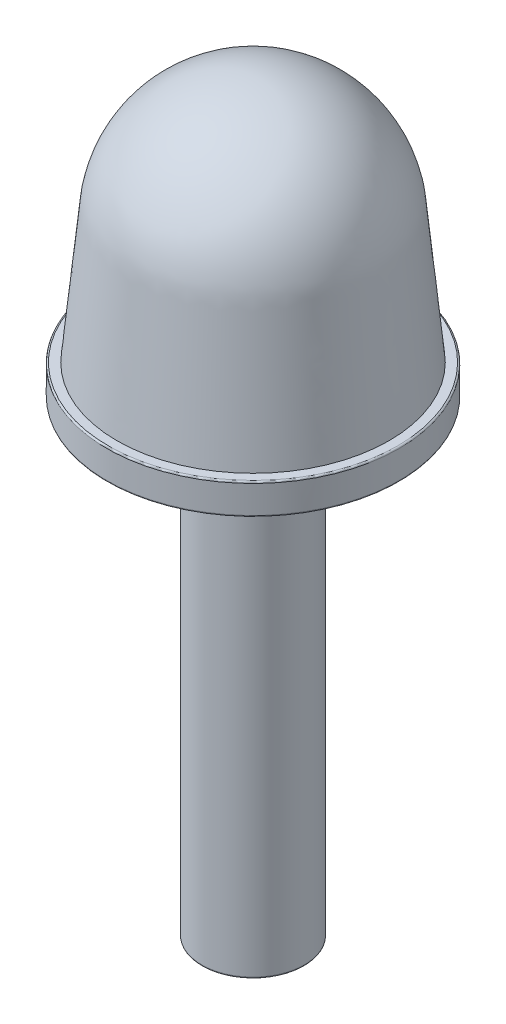
from build123d import *

# Parameters (mm, degrees)
FILLET2_R = 0.15


with BuildPart() as part:
    # Sketch1 → Revolve1 (revolve)
    with BuildSketch(Plane.XY, mode=Mode.PRIVATE) as revolve1_sk:
        with BuildLine():
            Line((0, 0), (0, -72.5))
            Line((0, -72.5), (5, -72.5))
            Line((5, -72.5), (5, -30))
            Line((5, -30), (9, -30))
            Line((9, -30), (9, -27))
            Line((9, -27), (14.25, -27))
            Line((14.25, -27), (14.25, -24))
            Line((14.25, -24), (13.25, -24))
            add(Edge.make_bspline(
                [(13.25, -24), (12.876288893, -20.234768096), (12.502577786, -16.469536192), (12.12886668, -12.704304288), (12.10802883, -12.494357794), (12.06635313, -12.074464806), (12.003839581, -11.444625323), (11.962163881, -11.024732334), (11.941326032, -10.81478584), (11.913600396, -10.535443194), (11.858149124, -9.976757903), (11.666555139, -9.148985732), (11.514124842, -8.608285073), (11.428528654, -8.340938262), (9.779050122, -3.189040311), (5.409513095, 0), (0, 0)],
                knots=[0, 0, 0, 0, 0.379321245, 0.379321245, 0.379321245, 0.400471912, 0.421622579, 0.442773246, 0.442773246, 0.442773246, 0.470915098, 0.499056951, 0.527198803, 0.527198803, 0.527198803, 1, 1, 1, 1], degree=3, weights=[1, 1, 1, 1, 1, 1, 1, 1, 1, 1, 1, 1, 1, 1, 0.871833681, 0.871833681, 1]))
        make_face()
    revolve(revolve1_sk.sketch.rotate(Axis((0, 0, 0), (0, -1, 0)), 180), axis=Axis((0, 0, 0), (0, -1, 0)))

    # Fillet2
    fillet2_edges = [part.edges().sort_by_distance(p)[0] for p in [
        (5, -72.5, 0),
        (5, -30, 0),
        (9, -30, 0),
        (9, -27, 0),
        (14.25, -27, 0),
        (14.25, -24, 0),
    ]]
    fillet(fillet2_edges, radius=FILLET2_R)


solid = part.part
